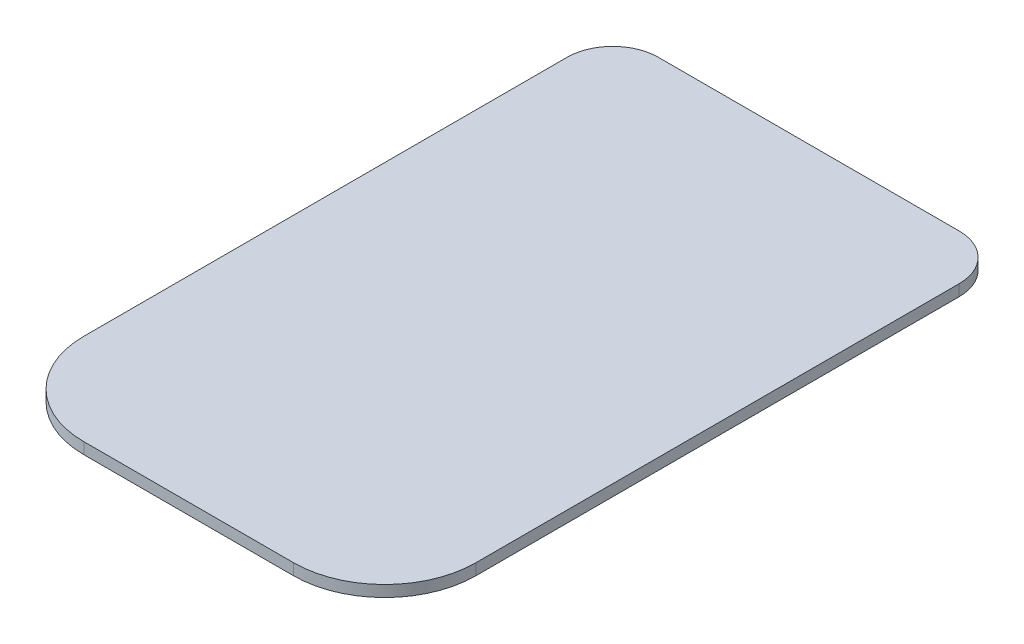
from build123d import *

# Parameters (mm, degrees)
BOSS_EXTRUDE1_DEPTH = 1.5748


with BuildPart() as part:
    # Sketch1 → Boss-Extrude1 (new body)
    with BuildSketch(Plane(origin=(0, 0, 0), x_dir=(1, 0, 0), z_dir=(0, 1, 0))):
        with BuildLine():
            Line((12.7, 0), (41.91, 0))
            ThreePointArc((41.91, 0), (50.890256121, 3.719743879), (54.61, 12.7))
            Line((54.61, 12.7), (54.61, 80.01))
            ThreePointArc((54.61, 80.01), (52.750128061, 84.500128061), (48.26, 86.36))
            Line((48.26, 86.36), (6.35, 86.36))
            ThreePointArc((6.35, 86.36), (1.859871939, 84.500128061), (0, 80.01))
            Line((0, 80.01), (0, 12.7))
            ThreePointArc((0, 12.7), (3.719743879, 3.719743879), (12.7, 0))
        make_face()
    extrude(amount=BOSS_EXTRUDE1_DEPTH)


solid = part.part
